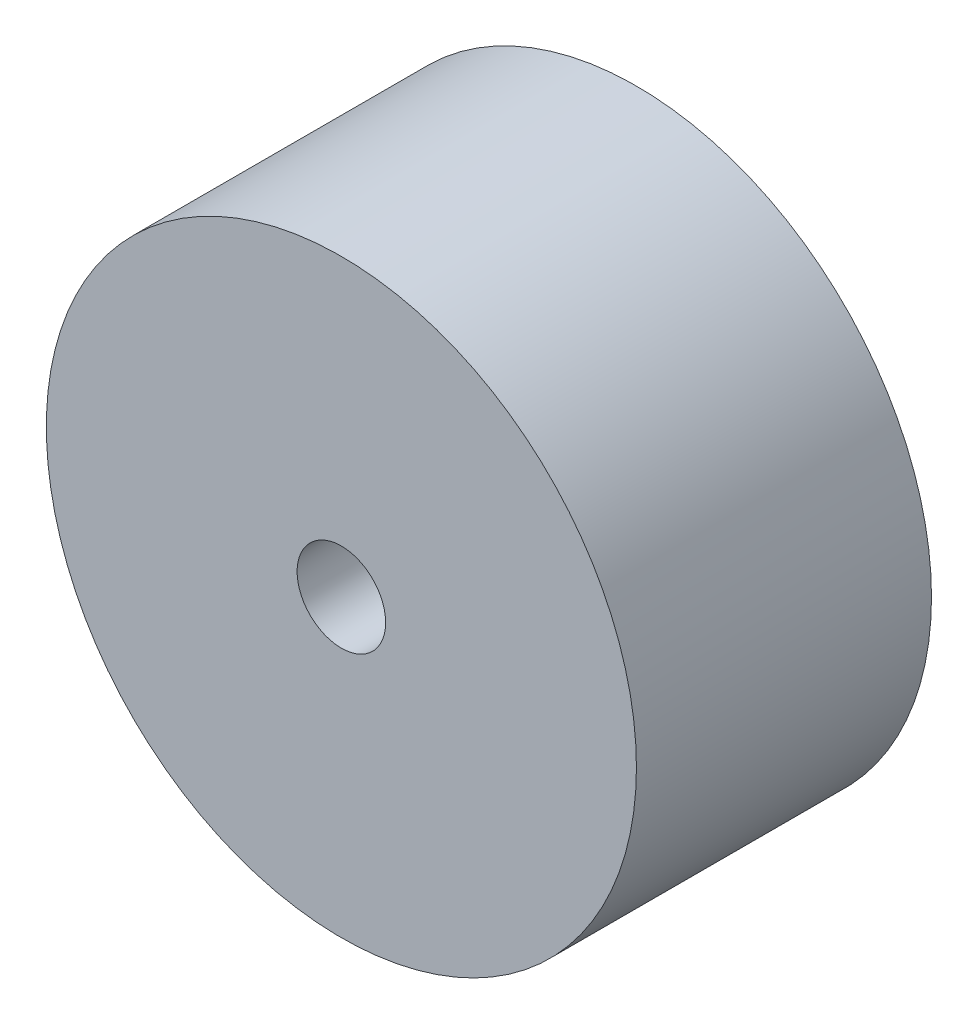
from build123d import *

# Parameters (mm, degrees)
SKETCH1_R           = 50
BOSS_EXTRUDE1_DEPTH = 50
SKETCH2_R           = 7.5
CUT_EXTRUDE1_DEPTH  = 50


with BuildPart() as part:
    # Sketch1 → Boss-Extrude1 (new body)
    with BuildSketch(Plane.XY):
        Circle(SKETCH1_R)
    extrude(amount=BOSS_EXTRUDE1_DEPTH)

    # Sketch2 → Cut-Extrude1 (cut)
    with BuildSketch(Plane.XY.offset(50)):
        Circle(SKETCH2_R)
    extrude(amount=-CUT_EXTRUDE1_DEPTH, mode=Mode.SUBTRACT)


solid = part.part
